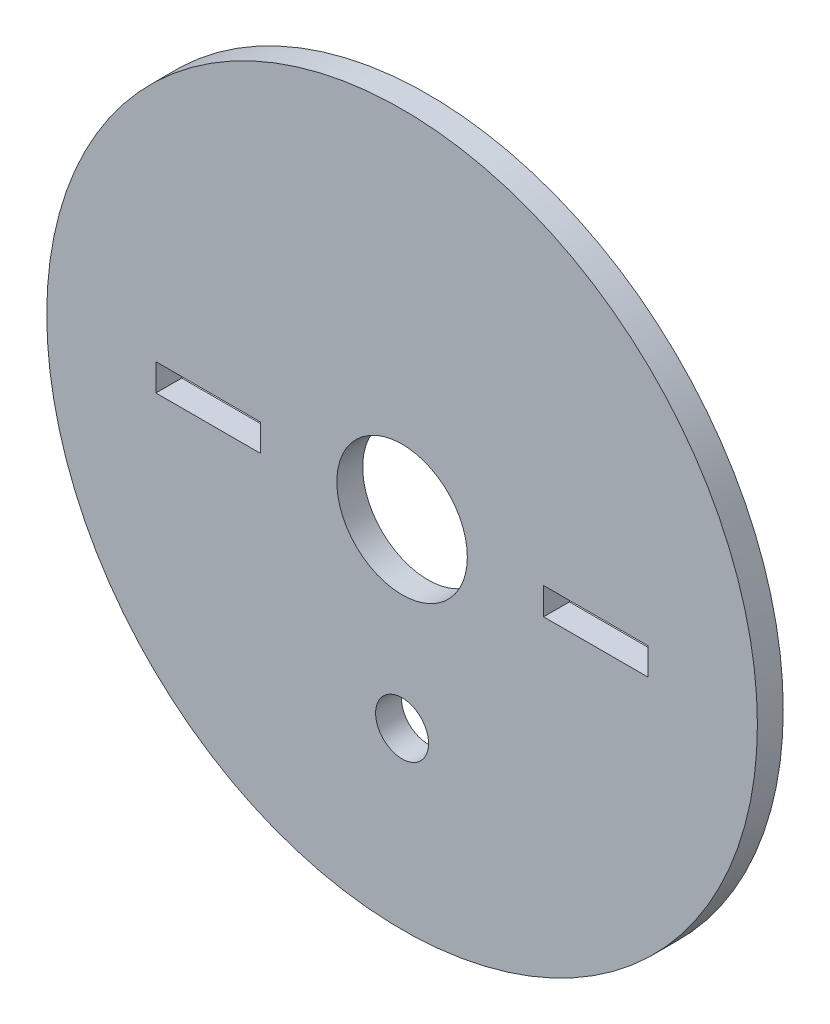
from build123d import *

# Parameters (mm, degrees)
SKETCH_1_R      = 27.5
SKETCH_1_R_2    = 2.05
SKETCH_1_R_3    = 5.05
SKETCH_1_W      = 8.1
SKETCH_1_H      = 2.1
EXTRUDE_1_DEPTH = 2


with BuildPart() as part:
    # 草图1 → 凸台-拉伸1 (new body)
    with BuildSketch(Plane.XY):
        with Locations((0, 14)):
            Circle(SKETCH_1_R)
        Circle(SKETCH_1_R_2, mode=Mode.SUBTRACT)
        with Locations((0, 14)):
            Circle(SKETCH_1_R_3, mode=Mode.SUBTRACT)
        with Locations((-15, 14)):
            Rectangle(SKETCH_1_W, SKETCH_1_H, mode=Mode.SUBTRACT)
        with Locations((15, 14)):
            Rectangle(SKETCH_1_W, SKETCH_1_H, mode=Mode.SUBTRACT)
    extrude(amount=EXTRUDE_1_DEPTH)


solid = part.part
